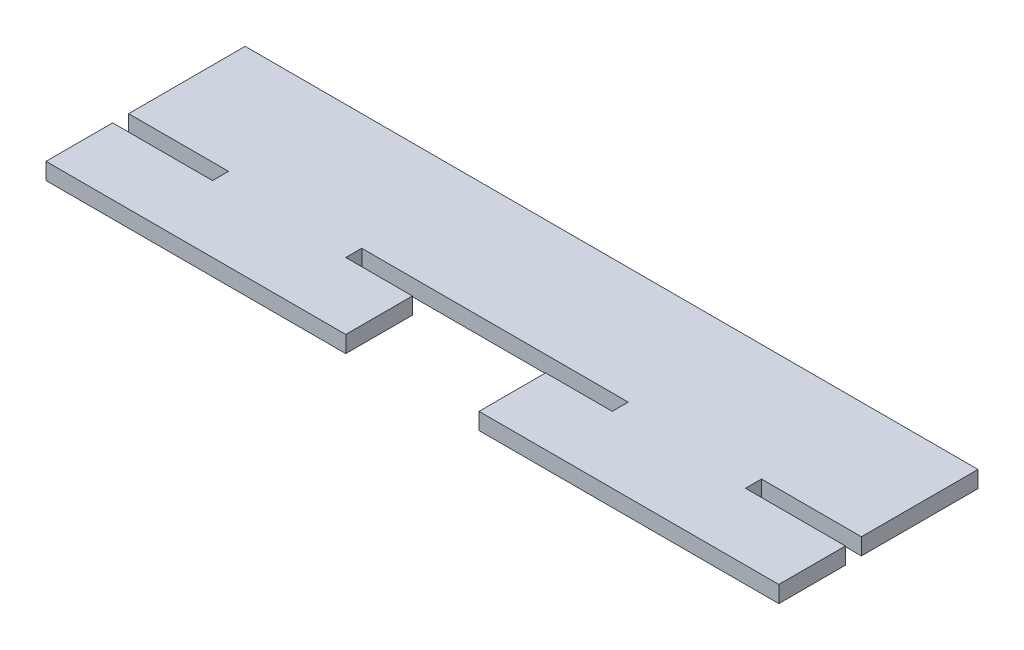
from build123d import *

# Parameters (mm, degrees)
BOSS_EXTRUDE1_DEPTH = 3.175


with BuildPart() as part:
    # Sketch1 → Boss-Extrude1 (new body)
    with BuildSketch(Plane(origin=(0, 0, 0), x_dir=(1, 0, 0), z_dir=(0, 1, 0))):
        Polygon((-69.85, 22.225), (69.85, 22.225), (69.85, 0), (50.8, 0), (50.8, -3.048), (69.85, -3.048), (69.85, -15.748), (12.7, -15.748), (12.7, -3.048), (25.4, -3.048), (25.4, 0), (-25.4, 0), (-25.4, -3.048), (-12.7, -3.048), (-12.7, -15.748), (-69.85, -15.748), (-69.85, -3.048), (-50.8, -3.048), (-50.8, 0), (-69.85, 0), align=None)
    extrude(amount=BOSS_EXTRUDE1_DEPTH)


solid = part.part
